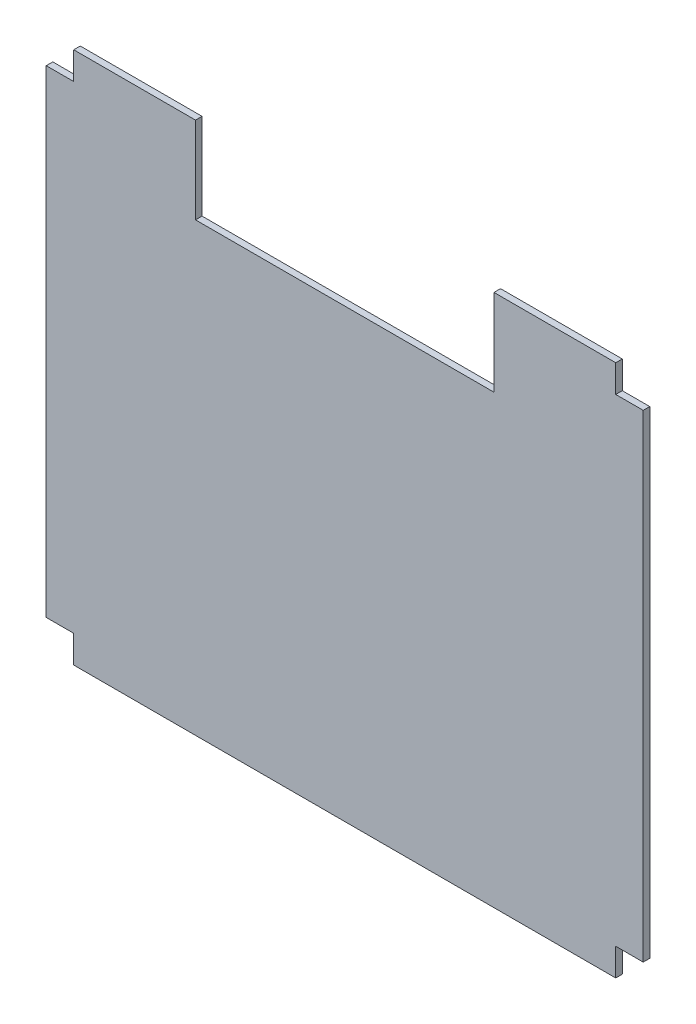
from build123d import *

# Parameters (mm, degrees)
BOSS_EXTRUDE1_DEPTH = 5


with BuildPart() as part:
    # Sketch1 → Boss-Extrude1 (new body)
    with BuildSketch(Plane.XY):
        Polygon((114, 137.5), (-114, 137.5), (-114, 203.5), (-207, 203.5), (-207, 182.5), (-228, 182.5), (-228, -182.5), (-207, -182.5), (-207, -203.5), (207, -203.5), (207, -182.5), (228, -182.5), (228, 182.5), (207, 182.5), (207, 203.5), (114, 203.5), align=None)
    extrude(amount=BOSS_EXTRUDE1_DEPTH)


solid = part.part
